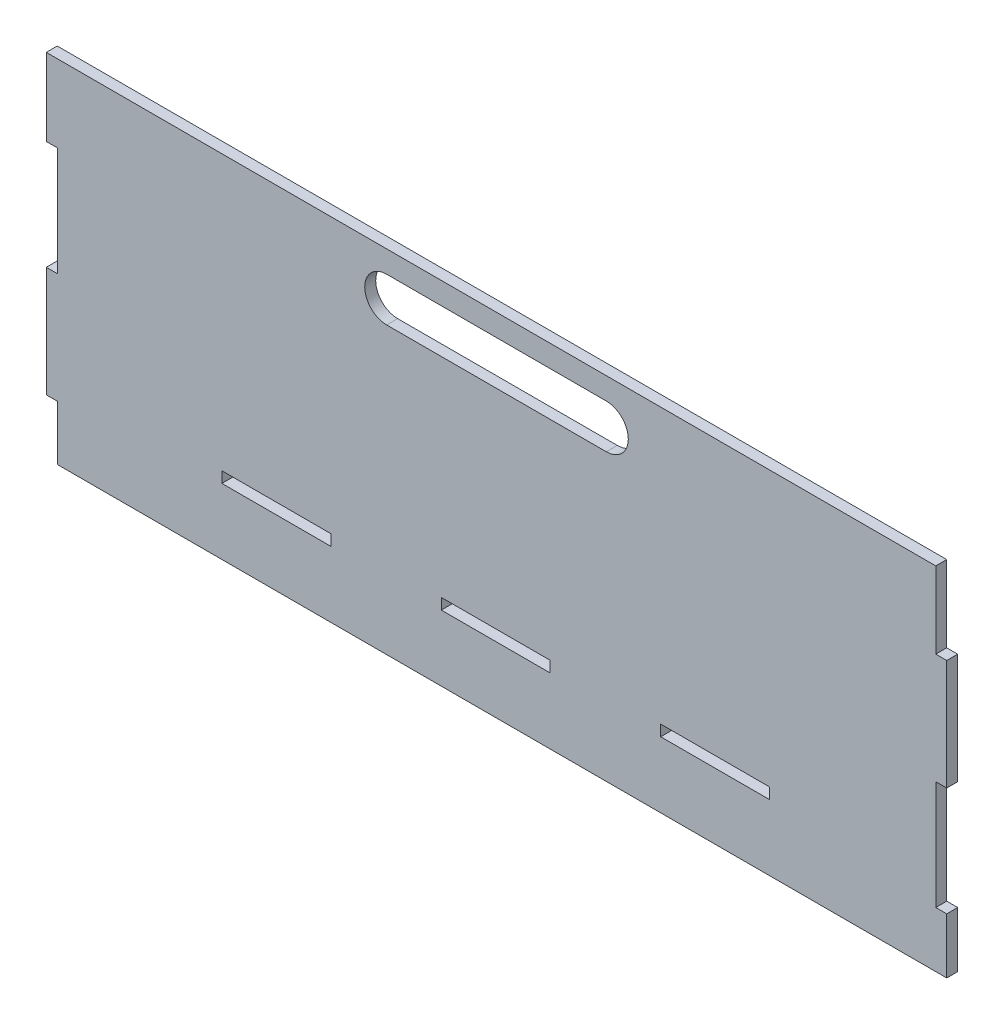
from build123d import *

# Parameters (mm, degrees)
SKIZZE1_W                       = 410
SKIZZE1_H                       = 300
AUFSATZ_LINEAR_AUSTRAGEN1_DEPTH = 5
SKIZZE2_W                       = 46.676040128
SKIZZE2_H                       = 49.6
SCHNITT_LINEAR_AUSTRAGEN1_DEPTH = 5
LINEARES_MUSTER1_COUNT          = 4
LINEARES_MUSTER1_PITCH          = 99.9
SKIZZE3_W                       = 27.663601369
SKIZZE3_H                       = 49.6
SCHNITT_LINEAR_AUSTRAGEN2_DEPTH = 5
LINEARES_MUSTER2_COUNT          = 3
LINEARES_MUSTER2_PITCH          = 99.9
SKIZZE4_W                       = 49.6
SKIZZE4_H                       = 5
SCHNITT_LINEAR_AUSTRAGEN3_DEPTH = 5
LINEARES_MUSTER3_COUNT          = 3
LINEARES_MUSTER3_PITCH          = 99.9
SCHNITT_LINEAR_AUSTRAGEN4_DEPTH = 5


with BuildPart() as part:
    # Skizze1 → Aufsatz-Linear austragen1 (new body)
    with BuildSketch(Plane.XY):
        with Locations((205, 150)):
            Rectangle(SKIZZE1_W, SKIZZE1_H)
    extrude(amount=AUFSATZ_LINEAR_AUSTRAGEN1_DEPTH)

    # Skizze2 → Schnitt-Linear austragen1 (cut)
    with BuildSketch(Plane.XY.offset(5)):
        with Locations((-18.338020064, 299.85)):
            Rectangle(SKIZZE2_W, SKIZZE2_H)
    schnitt_linear_austragen1 = extrude(amount=-SCHNITT_LINEAR_AUSTRAGEN1_DEPTH, mode=Mode.SUBTRACT)

    # Lineares Muster1: Schnitt-Linear austragen1 ×4
    with Locations(*[(0, -i * LINEARES_MUSTER1_PITCH, 0) for i in range(1, LINEARES_MUSTER1_COUNT)]):
        add(schnitt_linear_austragen1, mode=Mode.SUBTRACT)

    # Skizze3 → Schnitt-Linear austragen2 (cut)
    with BuildSketch(Plane.XY.offset(5)):
        with Locations((418.831800685, 249.9)):
            Rectangle(SKIZZE3_W, SKIZZE3_H)
    schnitt_linear_austragen2 = extrude(amount=-SCHNITT_LINEAR_AUSTRAGEN2_DEPTH, mode=Mode.SUBTRACT)

    # Lineares Muster2: Schnitt-Linear austragen2 ×3
    with Locations(*[(0, -i * LINEARES_MUSTER2_PITCH, 0) for i in range(1, LINEARES_MUSTER2_COUNT)]):
        add(schnitt_linear_austragen2, mode=Mode.SUBTRACT)

    # Skizze4 → Schnitt-Linear austragen3 (cut)
    with BuildSketch(Plane.XY.offset(5)):
        with Locations((104.75, 32.5)):
            Rectangle(SKIZZE4_W, SKIZZE4_H)
    schnitt_linear_austragen3 = extrude(amount=-SCHNITT_LINEAR_AUSTRAGEN3_DEPTH, mode=Mode.SUBTRACT)

    # Lineares Muster3: Schnitt-Linear austragen3 ×3
    with Locations(*[(i * LINEARES_MUSTER3_PITCH, 0, 0) for i in range(1, LINEARES_MUSTER3_COUNT)]):
        add(schnitt_linear_austragen3, mode=Mode.SUBTRACT)

    # Skizze5 → Schnitt-Linear austragen4 (cut)
    with BuildSketch(Plane.XY.offset(5)):
        Polygon((0, 160), (405, 160), (496.663114114, 346.337546914), (-27.8257996, 333.824324496), (-27.8257996, 200.492217914), align=None)
        with BuildLine():
            Line((155, 150), (255, 150))
            ThreePointArc((255, 150), (265, 140), (255, 130))
            Line((255, 130), (155, 130))
            ThreePointArc((155, 130), (145, 140), (155, 150))
        make_face()
    extrude(amount=-SCHNITT_LINEAR_AUSTRAGEN4_DEPTH, mode=Mode.SUBTRACT)


solid = part.part
